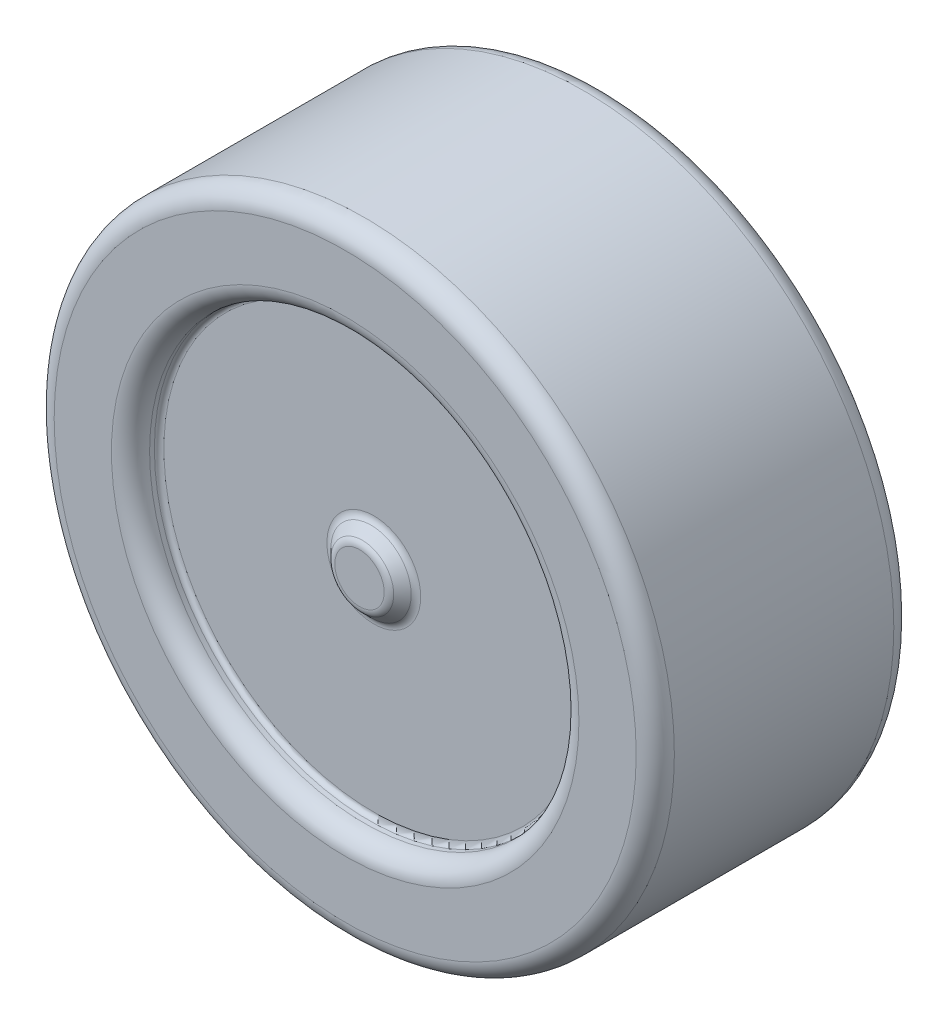
from build123d import *


with BuildPart() as part:
    # Sketch2 → Revolve1 (revolve)
    with BuildSketch(Plane(origin=(0, 0, 0), x_dir=(1, 0, 0), z_dir=(0, 1, 0)), mode=Mode.PRIVATE) as revolve1_sk:
        with BuildLine():
            Line((-30.5, 0), (-24.5, 0))
            ThreePointArc((-24.5, 0), (-23.085786438, 0.585786438), (-22.5, 2))
            Line((-22.5, 2), (-22.5, 2.5))
            ThreePointArc((-22.5, 2.5), (-22.353553391, 2.853553391), (-22, 3))
            Line((-22, 3), (-4.914213562, 3))
            ThreePointArc((-4.914213562, 3), (-4.53153013, 2.923879533), (-4.207106781, 2.707106781))
            Line((-4.207106781, 2.707106781), (-3.292893219, 1.792893219))
            ThreePointArc((-3.292893219, 1.792893219), (-2.96846987, 1.576120467), (-2.585786438, 1.5))
            Line((-2.585786438, 1.5), (0, 1.5))
            Line((0, 1.5), (0, 20))
            Line((0, 20), (-6, 20))
            Line((-6, 20), (-6, 12))
            ThreePointArc((-6, 12), (-6.585786438, 10.585786438), (-8, 10))
            Line((-8, 10), (-20.5, 10))
            ThreePointArc((-20.5, 10), (-21.914213562, 10.585786438), (-22.5, 12))
            Line((-22.5, 12), (-22.5, 25))
            ThreePointArc((-22.5, 25), (-23.085786438, 26.414213562), (-24.5, 27))
            Line((-24.5, 27), (-30.5, 27))
            ThreePointArc((-30.5, 27), (-31.914213562, 26.414213562), (-32.5, 25))
            Line((-32.5, 25), (-32.5, 2))
            ThreePointArc((-32.5, 2), (-31.914213562, 0.585786438), (-30.5, 0))
        make_face()
    revolve(revolve1_sk.sketch.rotate(Axis((0, 0, 0), (0, 0, -1)), 180), axis=Axis((0, 0, 0), (0, 0, -1)))


solid = part.part
